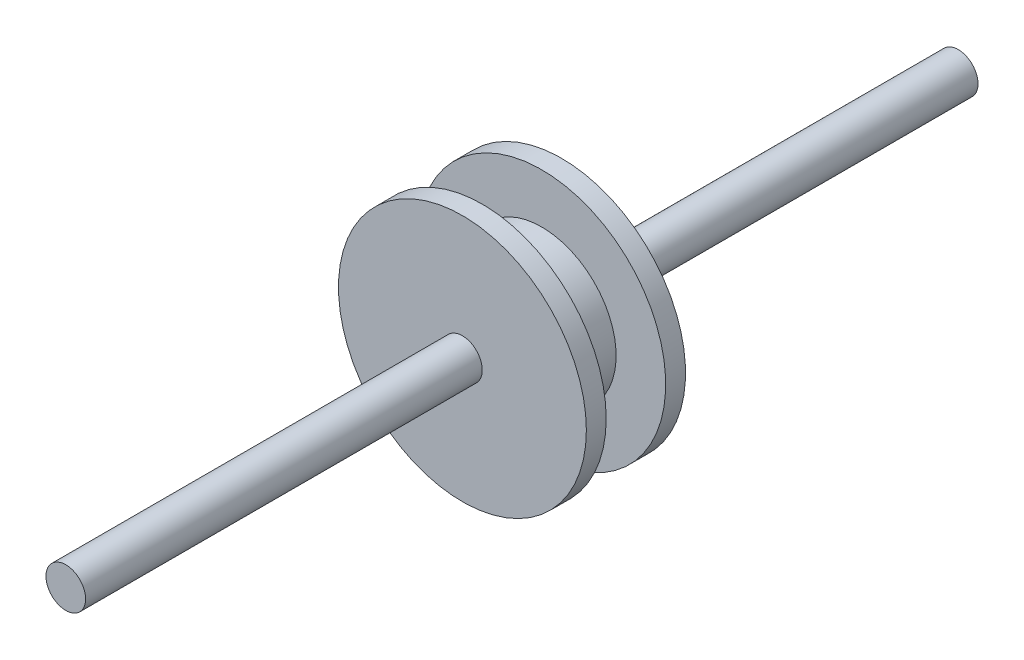
from build123d import *

# Parameters (mm, degrees)
SKETCH1_R           = 7.5
BOSS_EXTRUDE1_DEPTH = 10
SKETCH2_R           = 12.5
BOSS_EXTRUDE2_DEPTH = 2
BOSS_EXTRUDE3_START = -2
SKETCH3_R           = 12.5
BOSS_EXTRUDE3_DEPTH = 2
SKETCH4_R           = 2
BOSS_EXTRUDE4_DEPTH = 40
BOSS_EXTRUDE5_START = 40
SKETCH5_R           = 2
BOSS_EXTRUDE5_DEPTH = 40


with BuildPart() as part:
    # Sketch1 → Boss-Extrude1 (new body)
    with BuildSketch(Plane.XY):
        Circle(SKETCH1_R)
    extrude(amount=BOSS_EXTRUDE1_DEPTH)

    # Sketch2 → Boss-Extrude2 (add)
    with BuildSketch(Plane(origin=(0, 0, 0), x_dir=(-1, 0, 0), z_dir=(0, 0, -1))):
        Circle(SKETCH2_R)
    extrude(amount=-BOSS_EXTRUDE2_DEPTH)

    # Sketch3 → Boss-Extrude3 (add)
    with BuildSketch(Plane.XY.offset(10).offset(BOSS_EXTRUDE3_START)):
        with Locations(Location((0, 0, 0), (0, 0, 180))):
            Circle(SKETCH3_R)
    extrude(amount=BOSS_EXTRUDE3_DEPTH)

    # Sketch4 → Boss-Extrude4 (add)
    with BuildSketch(Plane.XY.offset(10)):
        Circle(SKETCH4_R)
    extrude(amount=BOSS_EXTRUDE4_DEPTH)

    # Sketch5 → Boss-Extrude5 (add)
    with BuildSketch(Plane(origin=(0, 0, 0), x_dir=(-1, 0, 0), z_dir=(0, 0, -1)).offset(BOSS_EXTRUDE5_START)):
        with Locations(Location((0, 0, 0), (0, 0, 180))):
            Circle(SKETCH5_R)
    extrude(amount=-BOSS_EXTRUDE5_DEPTH)


solid = part.part
